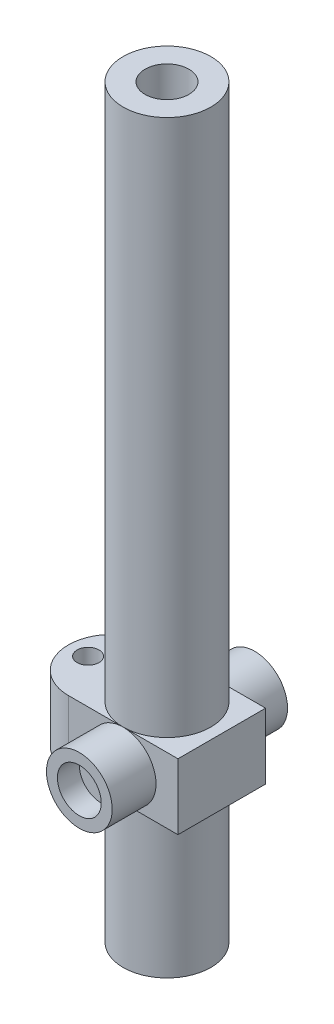
from build123d import *

# Parameters (mm, degrees)
SKETCH1_R           = 10
BOSS_EXTRUDE1_DEPTH = 170
SKETCH2_W           = 25
SKETCH2_H           = 15
BOSS_EXTRUDE3_DEPTH = 10
BOSS_EXTRUDE4_START = -10
SKETCH3_R           = 7.5
BOSS_EXTRUDE4_DEPTH = 20
SKETCH4_R           = 5
CUT_EXTRUDE1_DEPTH  = 80
SKETCH5_R           = 5
CUT_EXTRUDE2_DEPTH  = 5
BOSS_EXTRUDE5_DEPTH = 15
SKETCH7_R           = 2.5
CUT_EXTRUDE3_DEPTH  = 15


with BuildPart() as part:
    # Sketch1 → Boss-Extrude1 (new body)
    with BuildSketch(Plane(origin=(0, 0, 0), x_dir=(1, 0, 0), z_dir=(0, 1, 0))):
        with Locations(Location((0, 0, 0), (0, 0, 270))):
            Circle(SKETCH1_R)
    extrude(amount=BOSS_EXTRUDE1_DEPTH)

    # Sketch2 → Boss-Extrude3 (add, symmetric)
    with BuildSketch(Plane.XY):
        with Locations((0, 40)):
            Rectangle(SKETCH2_W, SKETCH2_H)
    extrude(amount=BOSS_EXTRUDE3_DEPTH, both=True)

    # Sketch3 → Boss-Extrude4 (add, symmetric)
    with BuildSketch(Plane.XY.offset(10).offset(BOSS_EXTRUDE4_START)):
        with Locations(Location((0, 40, 0), (0, 0, 270))):
            Circle(SKETCH3_R)
    extrude(amount=BOSS_EXTRUDE4_DEPTH, both=True)

    # Sketch4 → Cut-Extrude1 (cut)
    with BuildSketch(Plane(origin=(0, 170, 0), x_dir=(1, 0, 0), z_dir=(0, 1, 0))):
        with Locations(Location((0, 0, 0), (0, 0, 270))):
            Circle(SKETCH4_R)
    extrude(amount=-CUT_EXTRUDE1_DEPTH, mode=Mode.SUBTRACT)

    # Sketch5 → Cut-Extrude2 (cut)
    with BuildSketch(Plane(origin=(0, 0, -20), x_dir=(-1, 0, 0), z_dir=(0, 0, -1))):
        with Locations((0, 40)):
            Circle(SKETCH5_R)
    cut_extrude2 = extrude(amount=-CUT_EXTRUDE2_DEPTH, mode=Mode.SUBTRACT)

    # Mirror1: Cut-Extrude2 across plane
    add(cut_extrude2.mirror(Plane.XY), mode=Mode.SUBTRACT)

    # Sketch6 → Boss-Extrude5 (add)
    with BuildSketch(Plane.XZ.offset(-32.5)):
        with BuildLine():
            Line((-12.5, 10), (-12.5, -10))
            ThreePointArc((-12.5, -10), (-22.5, 0), (-12.5, 10))
        make_face()
    extrude(amount=-BOSS_EXTRUDE5_DEPTH)

    # Sketch7 → Cut-Extrude3 (cut)
    with BuildSketch(Plane.XZ.offset(-32.5)):
        with Locations(Location((-18, 0, 0), (0, 0, 270))):
            Circle(SKETCH7_R)
    extrude(amount=-CUT_EXTRUDE3_DEPTH, mode=Mode.SUBTRACT)


solid = part.part
